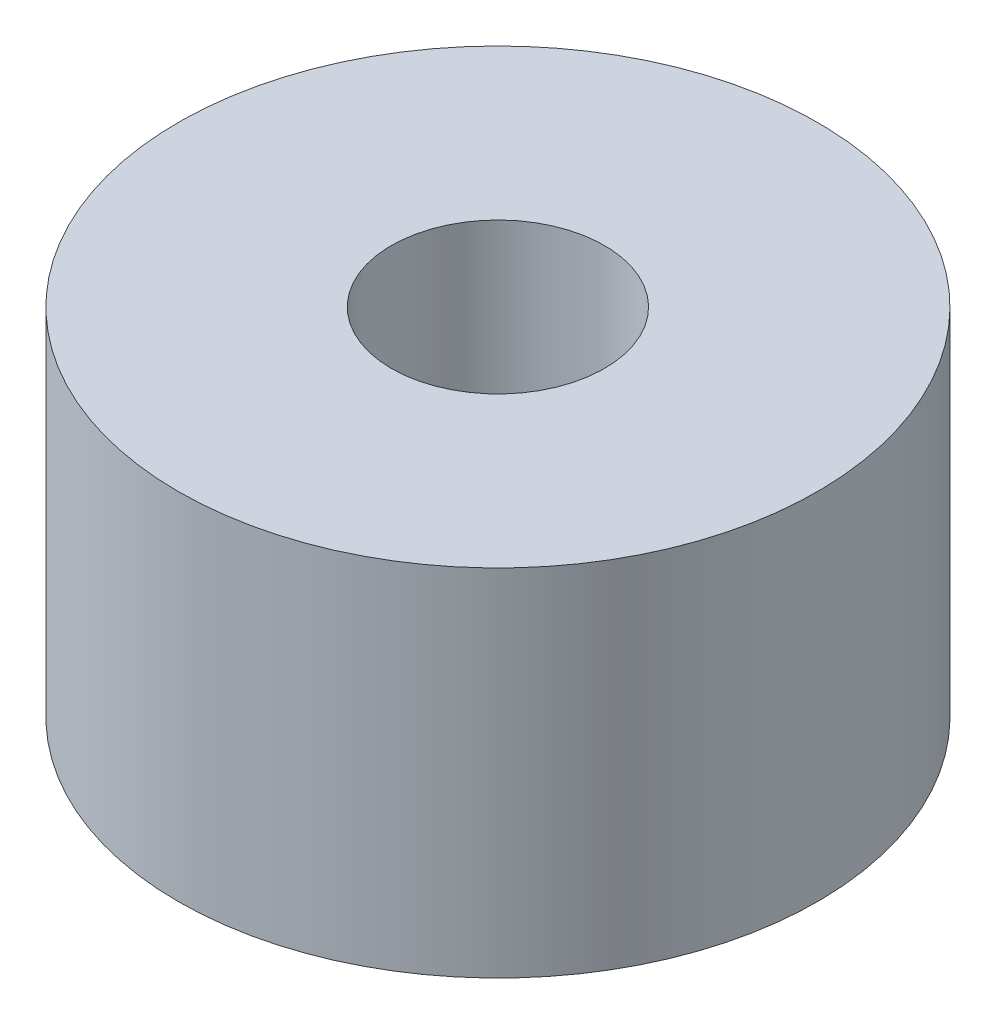
from build123d import *

# Parameters (mm, degrees)
SKETCH1_R   = 4.5
SKETCH1_R_2 = 1.5
BODY_DEPTH  = 5


with BuildPart() as part:
    # Sketch1 → Body (new body)
    with BuildSketch(Plane(origin=(0, 0, 0), x_dir=(1, 0, 0), z_dir=(0, 1, 0))):
        with Locations(Location((0, 0, 0), (0, 0, 270))):
            Circle(SKETCH1_R)
        with Locations(Location((0, 0, 0), (0, 0, 270))):
            Circle(SKETCH1_R_2, mode=Mode.SUBTRACT)
    extrude(amount=BODY_DEPTH)


solid = part.part
